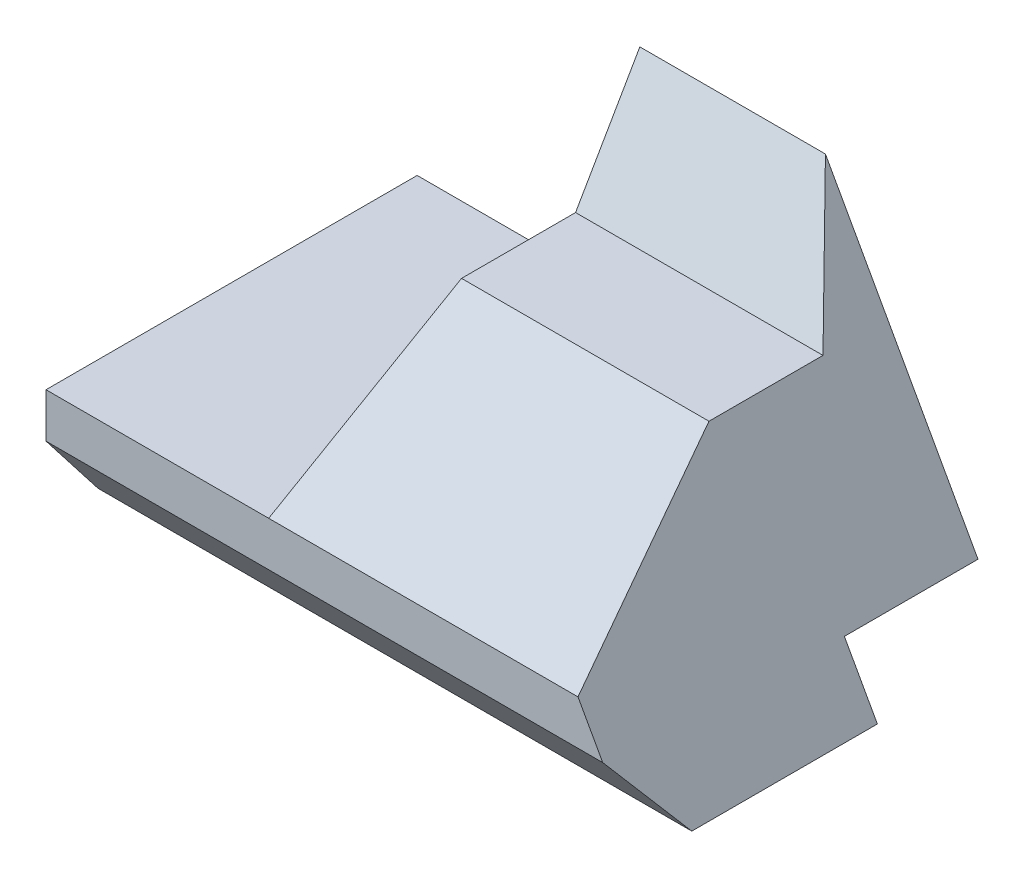
from build123d import *

# Parameters (mm, degrees)
RESSALTO_EXTRUS_O1_DEPTH          = 80
CORTE_EXTRUS_O2_REACH             = 103.336
ESBO_O2_W                         = 30
ESBO_O2_H                         = 30
CORTE_EXTRUS_O2_DIRECTION_2_DEPTH = 102.336074524
CORTE_EXTRUS_O3_REACH             = 103.336


with BuildPart() as part:
    # Esboço1 → Ressalto-extrusão1 (new body)
    with BuildSketch(Plane(origin=(0, 0, 0), x_dir=(0, 0, -1), z_dir=(1, 0, 0))):
        Polygon((-50, 7), (-24.019237886, 22), (-8.660254038, 22), (0, 37), (0, 0), (-18, 0), (-18, -8), (-43, -8), (-50, 1), align=None)
    extrude(amount=-RESSALTO_EXTRUS_O1_DEPTH)

    # Esboço2 → Corte-extrusão2 (cut, up to next)
    with BuildSketch(Plane.XY, mode=Mode.PRIVATE) as corte_extrus_o2_sk1:
        with Locations((-65, 22)):
            Rectangle(ESBO_O2_W, ESBO_O2_H)
    corte_extrus_o2_tool1 = extrude(corte_extrus_o2_sk1.sketch, amount=CORTE_EXTRUS_O2_REACH, mode=Mode.PRIVATE) & part.part
    add(corte_extrus_o2_tool1.solids().sort_by_distance((-65, 22, 0))[0], mode=Mode.SUBTRACT)

    # Esboço2 → Corte-extrusão2 direction 2 (cut)
    with BuildSketch(Plane.XY):
        with Locations((-65, 22)):
            Rectangle(ESBO_O2_W, ESBO_O2_H)
    extrude(amount=-CORTE_EXTRUS_O2_DIRECTION_2_DEPTH, mode=Mode.SUBTRACT)

    # Esboço3 → Corte-extrusão3 (cut, up to next)
    with BuildSketch(Plane.XY, mode=Mode.PRIVATE) as corte_extrus_o3_sk1:
        Polygon((-25, 37), (0, -8), (0, 37), align=None)
    corte_extrus_o3_tool1 = extrude(corte_extrus_o3_sk1.sketch, amount=CORTE_EXTRUS_O3_REACH, mode=Mode.PRIVATE) & part.part
    add(corte_extrus_o3_tool1.solids().sort_by_distance((-8.333333, 22, 0))[0], mode=Mode.SUBTRACT)


solid = part.part
